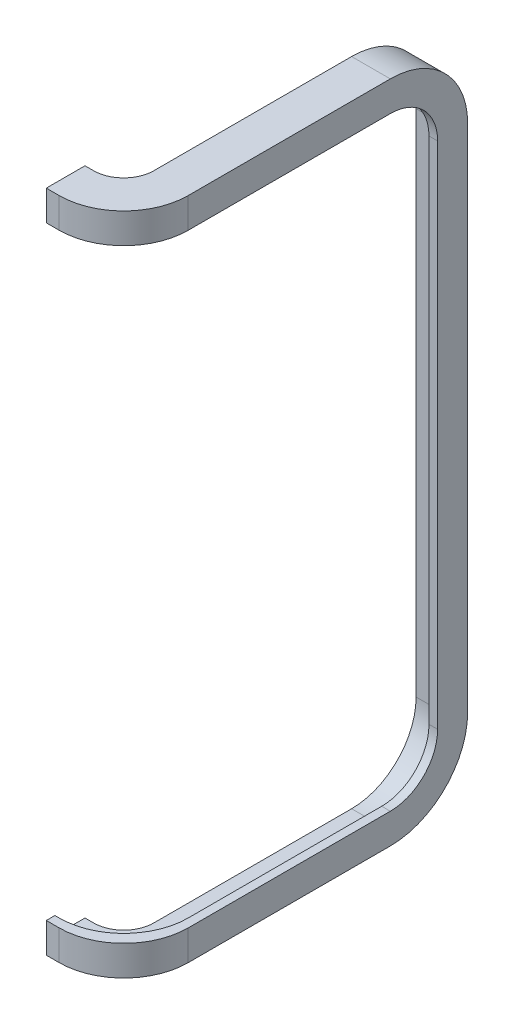
from build123d import *

# Parameters (mm, degrees)
EXTRUDE_1_DEPTH = 7
EXTRUDE_2_DEPTH = 2
SKETCH_4_W      = 7
SKETCH_4_H      = 3
EXTRUDE_3_DEPTH = 18
SKETCH_5_W      = 2
SKETCH_5_H      = 7
EXTRUDE_4_DEPTH = 18
FILLET_1_R      = 7
FILLET_2_R      = 15


with BuildPart() as part:
    # 스케치1 → 보스-돌출1 (new body)
    with BuildSketch(Plane(origin=(105.5, 0, 0), x_dir=(0, 0, -1), z_dir=(1, 0, 0))):
        with BuildLine():
            Line((0, 0), (60, 0))
            ThreePointArc((60, 0), (70.606601718, 4.393398282), (75, 15))
            Line((75, 15), (75, 133.5))
            ThreePointArc((75, 133.5), (70.606601718, 144.106601718), (60, 148.5))
            Line((60, 148.5), (0, 148.5))
            Line((0, 148.5), (0, 151.5))
            Line((0, 151.5), (60, 151.5))
            ThreePointArc((60, 151.5), (72.727922061, 146.227922061), (78, 133.5))
            Line((78, 133.5), (78, 15))
            ThreePointArc((78, 15), (72.727922061, 2.272077939), (60, -3))
            Line((60, -3), (0, -3))
            Line((0, -3), (0, 0))
        make_face()
    extrude(amount=EXTRUDE_1_DEPTH)

    # 스케치2 → 보스-돌출2 (add)
    with BuildSketch(Plane(origin=(112.5, 0, 0), x_dir=(0, 0, -1), z_dir=(1, 0, 0))):
        with BuildLine():
            Line((0, -3), (60, -3))
            ThreePointArc((60, -3), (72.727922061, 2.272077939), (78, 15))
            Line((78, 15), (78, 133.5))
            ThreePointArc((78, 133.5), (72.727922061, 146.227922061), (60, 151.5))
            Line((60, 151.5), (0, 151.5))
            Line((0, 151.5), (0, 144.5))
            Line((0, 144.5), (60, 144.5))
            ThreePointArc((60, 144.5), (67.778174593, 141.278174593), (71, 133.5))
            Line((71, 133.5), (71, 15))
            ThreePointArc((71, 15), (67.778174593, 7.221825407), (60, 4))
            Line((60, 4), (0, 4))
            Line((0, 4), (0, -3))
        make_face()
    extrude(amount=EXTRUDE_2_DEPTH)

    # 스케치4 → 보스-돌출3 (add)
    with BuildSketch(Plane(origin=(114.5, 0, 0), x_dir=(0, 0, -1), z_dir=(1, 0, 0))):
        with Locations((3.5, -1.5)):
            Rectangle(SKETCH_4_W, SKETCH_4_H)
        with Locations((3.5, 150)):
            Rectangle(SKETCH_4_W, SKETCH_4_H)
    extrude(amount=-EXTRUDE_3_DEPTH)

    # 스케치5 → 보스-돌출4 (add)
    with BuildSketch(Plane(origin=(114.5, 0, 0), x_dir=(0, 0, -1), z_dir=(1, 0, 0))):
        with Locations((-1, 0.5)):
            Rectangle(SKETCH_5_W, SKETCH_5_H)
        with Locations((-1, 148)):
            Rectangle(SKETCH_5_W, SKETCH_5_H)
    extrude(amount=-EXTRUDE_4_DEPTH)

    # 필렛1
    fillet_1_edges = [part.edges().sort_by_distance(p)[0] for p in [
        (105.5, 150, -7),
        (105.5, -1.5, -7),
    ]]
    fillet(fillet_1_edges, radius=FILLET_1_R)

    # 필렛2
    fillet_2_edges = [part.edges().sort_by_distance(p)[0] for p in [
        (114.5, 0.5, 2),
        (114.5, 148, 2),
        (112.5, 2, 0),
        (112.5, 146.5, 0),
    ]]
    fillet(fillet_2_edges, radius=FILLET_2_R)


solid = part.part
